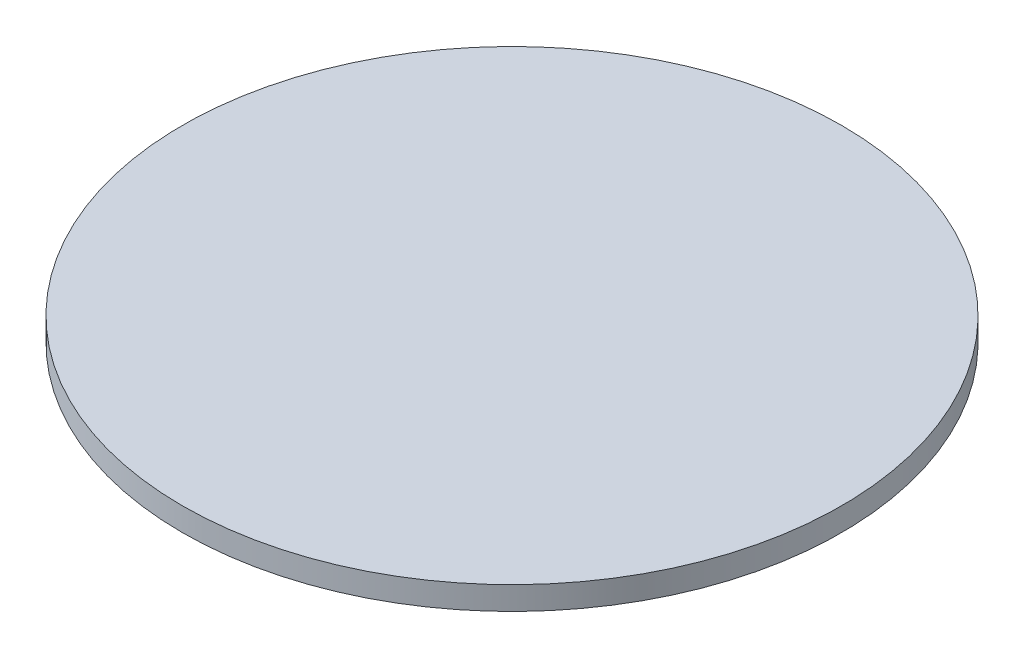
from build123d import *

# Parameters (mm, degrees)
SKETCH1_R           = 95
BOSS_EXTRUDE1_DEPTH = 6.7


with BuildPart() as part:
    # Sketch1 → Boss-Extrude1 (new body)
    with BuildSketch(Plane(origin=(0, 0, 0), x_dir=(1, 0, 0), z_dir=(0, 1, 0))):
        with Locations(Location((0, 0, 0), (0, 0, 270))):
            Circle(SKETCH1_R)
    extrude(amount=BOSS_EXTRUDE1_DEPTH)


solid = part.part
